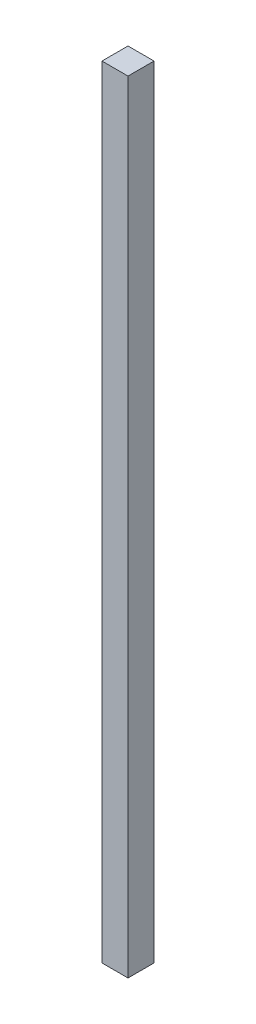
from build123d import *

# Parameters (mm, degrees)
SKETCH1_W           = 50
SKETCH1_H           = 50
BOSS_EXTRUDE1_DEPTH = 1500


with BuildPart() as part:
    # Sketch1 → Boss-Extrude1 (new body)
    with BuildSketch(Plane(origin=(0, 0, 0), x_dir=(1, 0, 0), z_dir=(0, 1, 0))):
        Rectangle(SKETCH1_W, SKETCH1_H)
    extrude(amount=BOSS_EXTRUDE1_DEPTH)


solid = part.part
